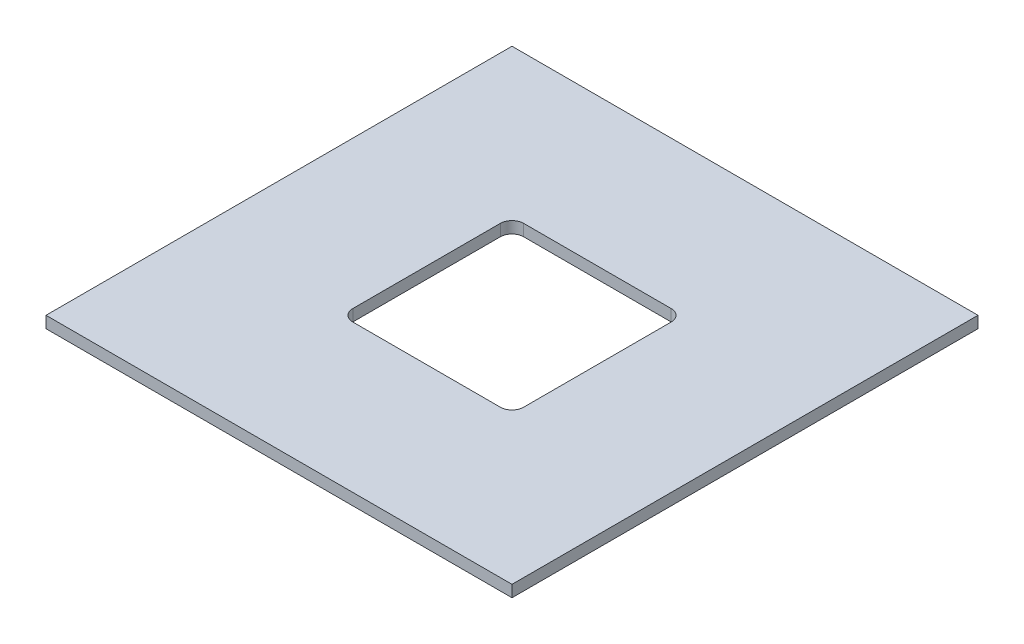
from build123d import *

# Parameters (mm, degrees)
SKETCH1_W           = 120
SKETCH1_H           = 120
BOSS_EXTRUDE1_DEPTH = 3


with BuildPart() as part:
    # Sketch1 → Boss-Extrude1 (new body)
    with BuildSketch(Plane(origin=(0, 0, 0), x_dir=(1, 0, 0), z_dir=(0, 1, 0))):
        with Locations((22, 22)):
            Rectangle(SKETCH1_W, SKETCH1_H)
        with BuildLine():
            Line((3, 0), (41, 0))
            ThreePointArc((41, 0), (43.121320344, 0.878679656), (44, 3))
            Line((44, 3), (44, 41))
            ThreePointArc((44, 41), (43.121320344, 43.121320344), (41, 44))
            Line((41, 44), (3, 44))
            ThreePointArc((3, 44), (0.878679656, 43.121320344), (0, 41))
            Line((0, 41), (0, 3))
            ThreePointArc((0, 3), (0.878679656, 0.878679656), (3, 0))
        make_face(mode=Mode.SUBTRACT)
    extrude(amount=BOSS_EXTRUDE1_DEPTH)


solid = part.part
